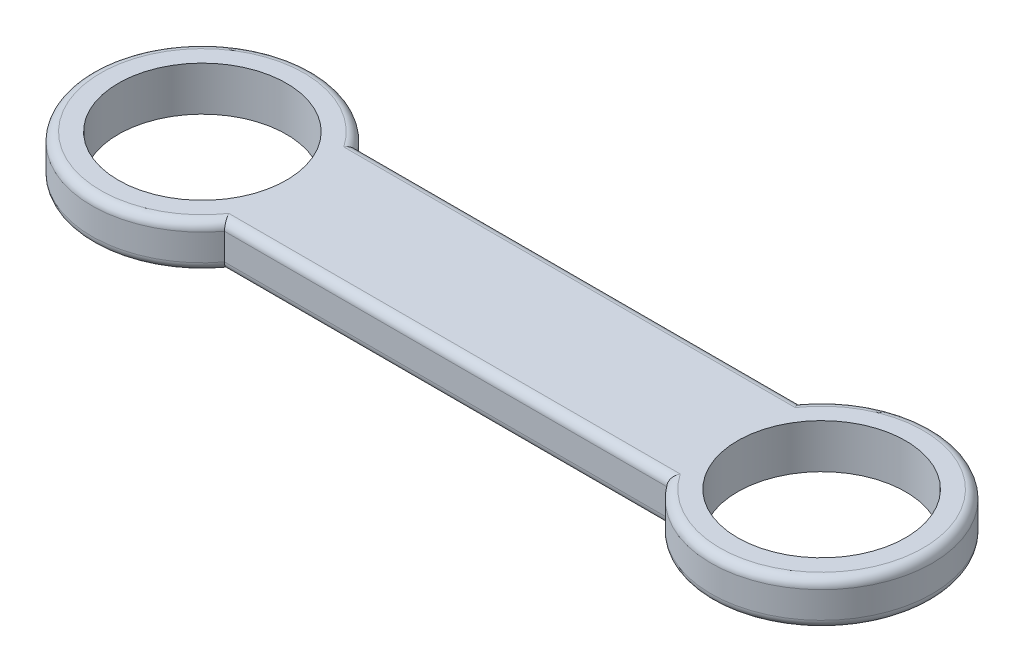
from build123d import *

# Parameters (mm, degrees)
SKETCH1_R           = 9.5
BOSS_EXTRUDE1_DEPTH = 5
FILLET1_R           = 1


with BuildPart() as part:
    # Sketch1 → Boss-Extrude1 (new body)
    with BuildSketch(Plane(origin=(0, 0, 0), x_dir=(1, 0, 0), z_dir=(0, 1, 0))):
        with BuildLine():
            Line((10, 7.5), (60, 7.5))
            ThreePointArc((60, 7.5), (82.5, 0), (60, -7.5))
            Line((60, -7.5), (10, -7.5))
            ThreePointArc((10, -7.5), (-12.5, 0), (10, 7.5))
        make_face()
        with Locations(Location((0, 0, 0), (0, 0, 270))):
            Circle(SKETCH1_R, mode=Mode.SUBTRACT)
        with Locations(Location((70, 0, 0), (0, 0, 270))):
            Circle(SKETCH1_R, mode=Mode.SUBTRACT)
    extrude(amount=BOSS_EXTRUDE1_DEPTH)

    # Fillet1
    fillet1_edges = [part.edges().sort_by_distance(p)[0] for p in [
        (82.5, 5, 0),
        (35, 5, -7.5),
        (-12.5, 5, 0),
        (35, 0, -7.5),
        (82.5, 0, 0),
        (35, 0, 7.5),
        (-12.5, 0, 0),
        (35, 5, 7.5),
    ]]
    fillet(fillet1_edges, radius=FILLET1_R)


solid = part.part
